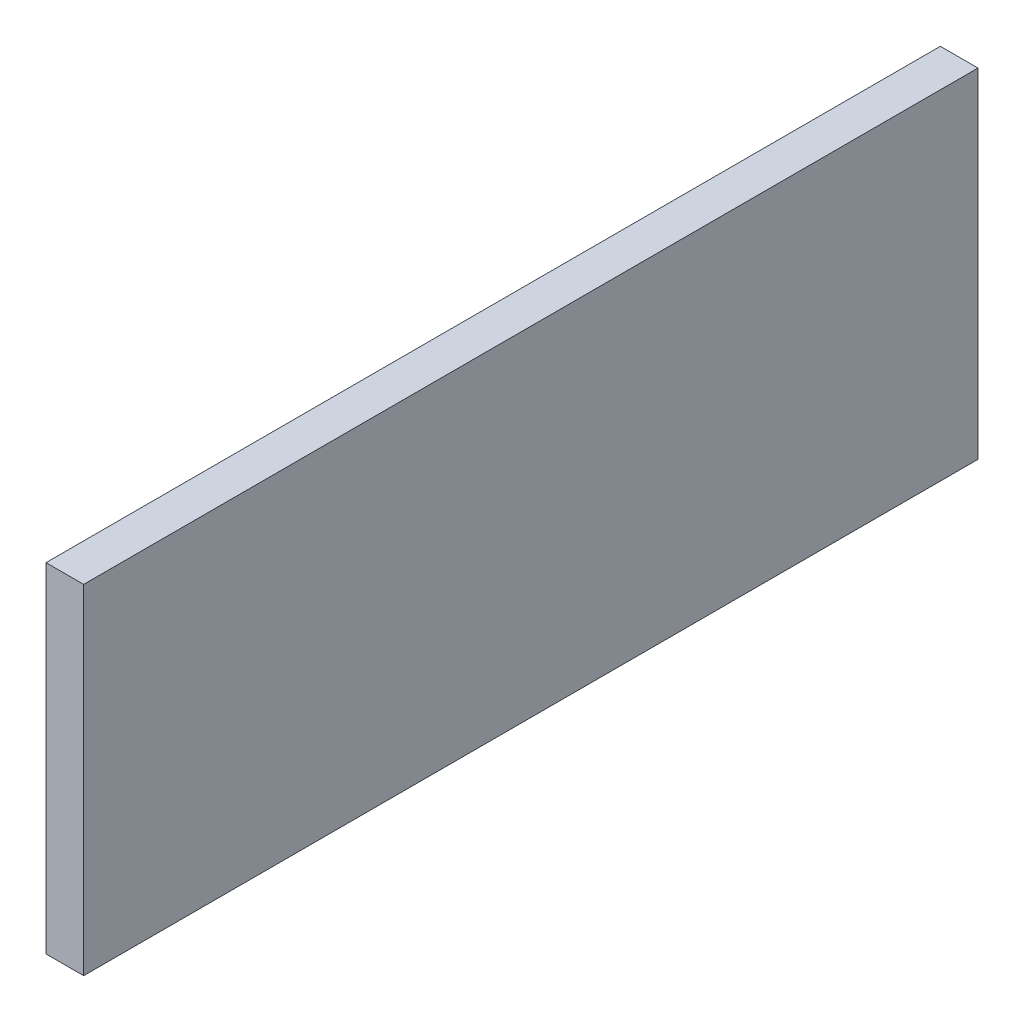
from build123d import *

# Parameters (mm, degrees)
SKETCH2_W           = 50
SKETCH2_H           = 22.5
BOSS_EXTRUDE1_DEPTH = 10
USBC_DEPTH          = 10
POGO_DEPTH          = 10
SKETCH6_W           = 48
SKETCH6_H           = 18.5
CUT_EXTRUDE3_DEPTH  = 8
SKETCH7_W           = 47.5
SKETCH7_H           = 18
BOSS_EXTRUDE2_DEPTH = 2
SKETCH8_W           = 10
SKETCH8_H           = 22.5
CUT_EXTRUDE4_DEPTH  = 57.127087934


with BuildPart() as part:
    # Sketch2 → Boss-Extrude1 (new body)
    with BuildSketch(Plane(origin=(0, 0, 0), x_dir=(0, 0, -1), z_dir=(1, 0, 0))):
        with Locations((25, 11.25)):
            Rectangle(SKETCH2_W, SKETCH2_H)
    extrude(amount=BOSS_EXTRUDE1_DEPTH)

    # Sketch4 → USBC (cut)
    with BuildSketch(Plane.XY):
        with BuildLine():
            Line((7.05, 14.275), (7.05, 8.225))
            ThreePointArc((7.05, 8.225), (5.325, 6.5), (3.6, 8.225))
            Line((3.6, 8.225), (3.6, 14.275))
            ThreePointArc((3.6, 14.275), (5.325, 16), (7.05, 14.275))
        make_face()
    extrude(amount=-USBC_DEPTH, mode=Mode.SUBTRACT)

    # Sketch5 → POGO (cut)
    with BuildSketch(Plane(origin=(0, 0, -50), x_dir=(-1, 0, 0), z_dir=(0, 0, -1))):
        with BuildLine():
            Line((-3, 16.25), (-3, 6.25))
            ThreePointArc((-3, 6.25), (-5.225, 4.025), (-7.45, 6.25))
            Line((-7.45, 6.25), (-7.45, 16.25))
            ThreePointArc((-7.45, 16.25), (-5.225, 18.475), (-3, 16.25))
        make_face()
    extrude(amount=-POGO_DEPTH, mode=Mode.SUBTRACT)

    # Sketch6 → Cut-Extrude3 (cut)
    with BuildSketch(Plane(origin=(10, 0, 0), x_dir=(0, 0, -1), z_dir=(1, 0, 0))):
        with Locations((25, 11.25)):
            Rectangle(SKETCH6_W, SKETCH6_H)
    extrude(amount=-CUT_EXTRUDE3_DEPTH, mode=Mode.SUBTRACT)

    # Sketch8 → Cut-Extrude4 (cut, through all)
    with BuildSketch(Plane.XY):
        with Locations((5, 11.25)):
            Rectangle(SKETCH8_W, SKETCH8_H)
    extrude(amount=-CUT_EXTRUDE4_DEPTH, mode=Mode.SUBTRACT)


with BuildPart() as body_2:
    # Sketch7 → Boss-Extrude2 (new body)
    with BuildSketch(Plane(origin=(10, 0, 0), x_dir=(0, 0, -1), z_dir=(1, 0, 0))):
        with Locations((25, 11.25)):
            Rectangle(SKETCH7_W, SKETCH7_H)
    extrude(amount=BOSS_EXTRUDE2_DEPTH)


solid = body_2.part
